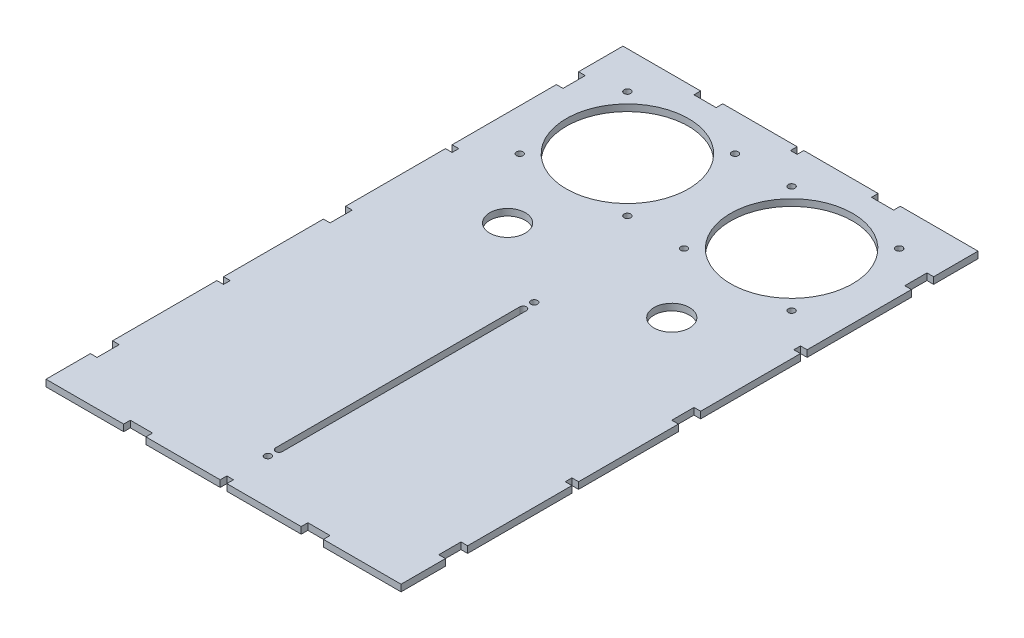
from build123d import *

# Parameters (mm, degrees)
SKETCH1_W           = 160
SKETCH1_H           = 260
BOSS_EXTRUDE1_DEPTH = 3
SKETCH2_R           = 1.5
SKETCH2_R_2         = 8
SKETCH2_R_3         = 27.5
CUT_EXTRUDE1_DEPTH  = 3
SKETCH7_W           = 3
SKETCH7_H           = 3
SKETCH7_W_2         = 10
SKETCH7_H_2         = 10
CUT_EXTRUDE2_DEPTH  = 171.026468528


with BuildPart() as part:
    # Sketch1 → Boss-Extrude1 (new body)
    with BuildSketch(Plane(origin=(0, 0, 0), x_dir=(1, 0, 0), z_dir=(0, 1, 0))):
        with Locations((0, -20)):
            Rectangle(SKETCH1_W, SKETCH1_H)
    extrude(amount=BOSS_EXTRUDE1_DEPTH)

    # Sketch2 → Cut-Extrude1 (cut)
    with BuildSketch(Plane(origin=(0, 3, 0), x_dir=(1, 0, 0), z_dir=(0, 1, 0))):
        with Locations(Location((0, -10, 0), (0, 0, 270))):
            Circle(SKETCH2_R)
        with Locations(Location((0, -130, 0), (0, 0, 270))):
            Circle(SKETCH2_R)
        with Locations(Location((-37, 15, 0), (0, 0, 270))):
            Circle(SKETCH2_R_2)
        with Locations(Location((-12.75, 93.25, 0), (0, 0, 270))):
            Circle(SKETCH2_R)
        with Locations(Location((37, 15, 0), (0, 0, 90))):
            Circle(SKETCH2_R_2)
        with Locations(Location((-12.75, 44.75, 0), (0, 0, 270))):
            Circle(SKETCH2_R)
        with Locations(Location((-61.25, 44.75, 0), (0, 0, 270))):
            Circle(SKETCH2_R)
        with Locations(Location((-61.25, 93.25, 0), (0, 0, 270))):
            Circle(SKETCH2_R)
        with Locations(Location((37, 69, 0), (0, 0, 90))):
            Circle(SKETCH2_R_3)
        with Locations(Location((12.75, 44.75, 0), (0, 0, 90))):
            Circle(SKETCH2_R)
        with Locations(Location((61.25, 44.75, 0), (0, 0, 90))):
            Circle(SKETCH2_R)
        with Locations(Location((61.25, 93.25, 0), (0, 0, 90))):
            Circle(SKETCH2_R)
        with Locations(Location((-37, 69, 0), (0, 0, 270))):
            Circle(SKETCH2_R_3)
        with Locations(Location((12.75, 93.25, 0), (0, 0, 90))):
            Circle(SKETCH2_R)
        with BuildLine():
            Line((1.5, -15), (1.5, -125))
            ThreePointArc((1.5, -125), (0, -126.5), (-1.5, -125))
            Line((-1.5, -125), (-1.5, -15))
            ThreePointArc((-1.5, -15), (0, -13.5), (1.5, -15))
        make_face()
    extrude(amount=-CUT_EXTRUDE1_DEPTH, mode=Mode.SUBTRACT)

    # Sketch7 → Cut-Extrude2 (cut, through all)
    with BuildSketch(Plane(origin=(0, 3, 0), x_dir=(1, 0, 0), z_dir=(0, 1, 0))):
        with Locations((0, 108.5)):
            Rectangle(SKETCH7_W, SKETCH7_H)
        with Locations((40, 108.5)):
            Rectangle(SKETCH7_W_2, SKETCH7_H)
        with Locations((-40, 108.5)):
            Rectangle(SKETCH7_W_2, SKETCH7_H)
        with Locations((40, -148.5)):
            Rectangle(SKETCH7_W_2, SKETCH7_H)
        with Locations((-40, -148.5)):
            Rectangle(SKETCH7_W_2, SKETCH7_H)
        with Locations((0, -148.5)):
            Rectangle(SKETCH7_W, SKETCH7_H)
        with Locations((-78.5, -125)):
            Rectangle(SKETCH7_W, SKETCH7_H_2)
        with Locations((-78.5, -20)):
            Rectangle(SKETCH7_W, SKETCH7_H_2)
        with Locations((-78.5, 85)):
            Rectangle(SKETCH7_W, SKETCH7_H_2)
        with Locations((-78.5, -71.5)):
            Rectangle(SKETCH7_W, SKETCH7_H)
        with Locations((-78.5, 31.5)):
            Rectangle(SKETCH7_W, SKETCH7_H)
        with Locations((78.5, -125)):
            Rectangle(SKETCH7_W, SKETCH7_H_2)
        with Locations((78.5, -71.5)):
            Rectangle(SKETCH7_W, SKETCH7_H)
        with Locations((78.5, -20)):
            Rectangle(SKETCH7_W, SKETCH7_H_2)
        with Locations((78.5, 31.5)):
            Rectangle(SKETCH7_W, SKETCH7_H)
        with Locations((78.5, 85)):
            Rectangle(SKETCH7_W, SKETCH7_H_2)
    extrude(amount=-CUT_EXTRUDE2_DEPTH, mode=Mode.SUBTRACT)


solid = part.part
